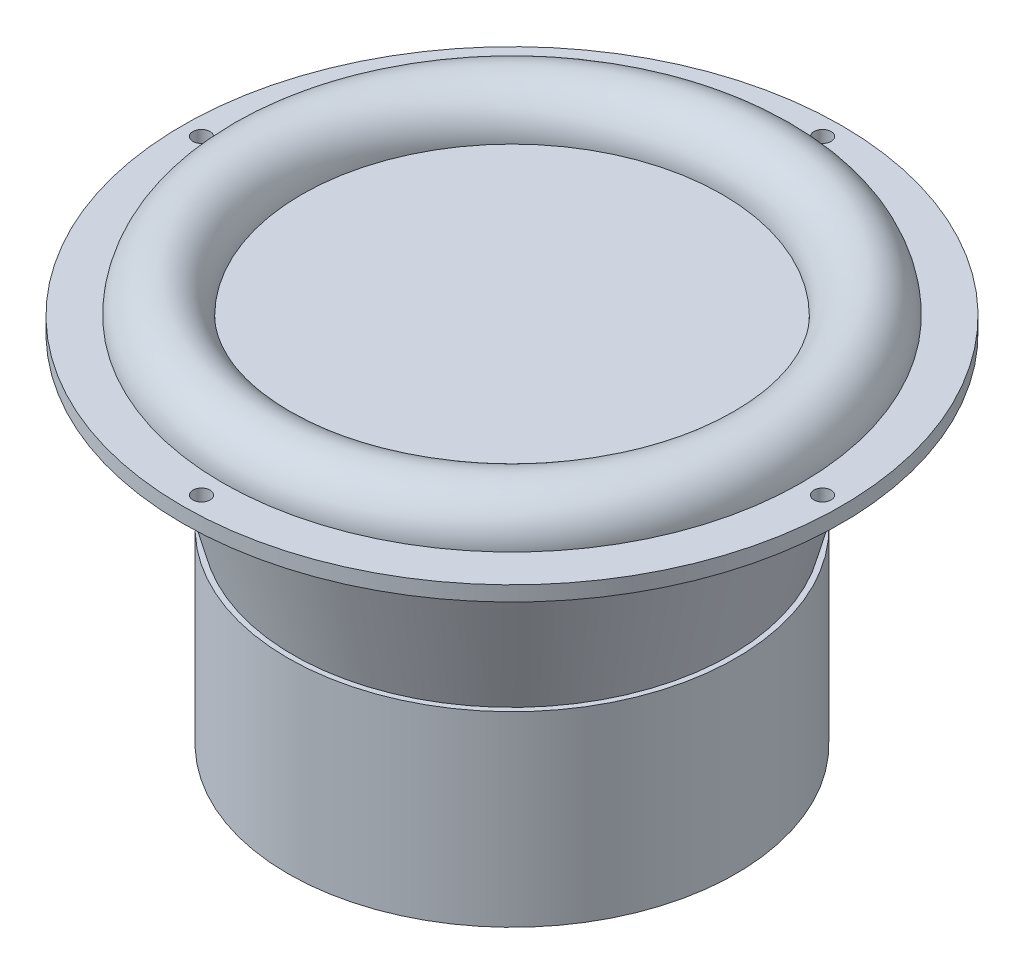
from build123d import *

# Parameters (mm, degrees)
F_4_6_4_6_DIAMETER_HOLE1_D = 4.6


with BuildPart() as part:
    # Sketch1 → Revolve1 (revolve)
    with BuildSketch(Plane.XY, mode=Mode.PRIVATE) as revolve1_sk:
        with BuildLine():
            Line((0, 99.4), (56.3, 99.4))
            ThreePointArc((56.3, 99.4), (66.9, 110), (77.5, 99.4))
            Line((77.5, 99.4), (88.25, 99.4))
            Line((88.25, 99.4), (88.25, 95.4))
            Line((88.25, 95.4), (70.75, 95.4))
            Line((70.75, 95.4), (58.585106664, 50))
            Line((58.585106664, 50), (60, 50))
            Line((60, 50), (60, 0))
            Line((60, 0), (0, 0))
            Line((0, 0), (0, 99.4))
        make_face()
    revolve(revolve1_sk.sketch.rotate(Axis((0, -46.308457921, 0), (0, 1, 0)), 90), axis=Axis((0, -46.308457921, 0), (0, 1, 0)))

    # Ø4.6 (4.6) Diameter Hole1 (through all)
    with Locations(Plane(origin=(0, 99.4, 0), x_dir=(1, 0, 0), z_dir=(0, 1, 0))):
        with Locations((0, -83.15), (-83.15, 0), (0, 83.15), (83.15, 0)):
            Hole(F_4_6_4_6_DIAMETER_HOLE1_D / 2)


solid = part.part
